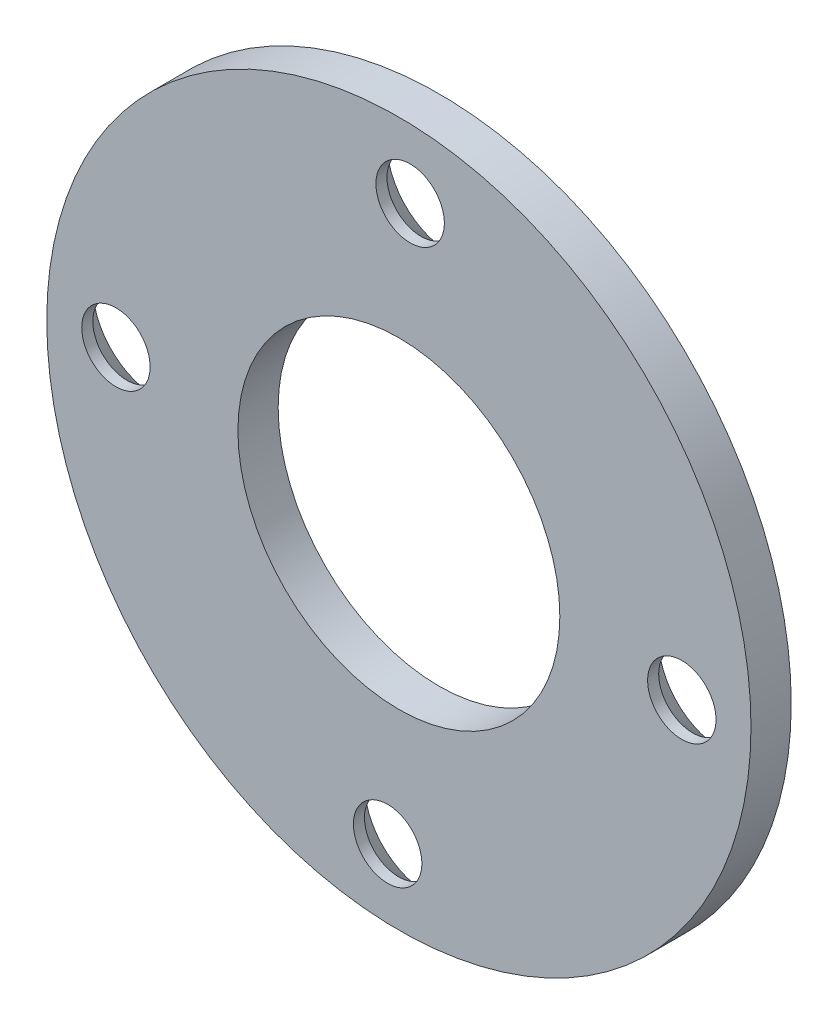
from build123d import *

# Parameters (mm, degrees)
SKETCH1_R                                    = 17.5
SKETCH1_R_2                                  = 8
BOSS_EXTRUDE1_DEPTH                          = 2
CSK_FOR_M3_COUNTERSUNK_FLAT_HEAD_SCR_2_COUNT = 2
CSK_FOR_M3_COUNTERSUNK_FLAT_HEAD_SCR_2_PITCH = 19.902355243
CSK_FOR_M3_COUNTERSUNK_FLAT_HEAD_SCR_3_COUNT = 2
CSK_FOR_M3_COUNTERSUNK_FLAT_HEAD_SCR_3_PITCH = 28.146180708
CSK_FOR_M3_COUNTERSUNK_FLAT_HEAD_SCR_4_COUNT = 2
CSK_FOR_M3_COUNTERSUNK_FLAT_HEAD_SCR_4_PITCH = 19.902355243


with BuildPart() as part:
    # Sketch1 → Boss-Extrude1 (new body)
    with BuildSketch(Plane.XY):
        Circle(SKETCH1_R)
        Circle(SKETCH1_R_2, mode=Mode.SUBTRACT)
    extrude(amount=BOSS_EXTRUDE1_DEPTH)

    # Sketch3 → CSK for M3 Countersunk Flat Head Screw1 (revolve, cut)
    with BuildSketch(Plane(origin=(0.559155654, 14.061977708, 0), x_dir=(0, 1, 0), z_dir=(1, 0, 0))):
        Polygon((0, 0), (0, 2), (1.7, 2), (1.7, 1.45), (3.15, 0), align=None)
    csk_for_m3_countersunk_flat_head_screw1 = revolve(axis=Axis((0.559155654, 14.061977708, -6.35), (0, 0, 1)), mode=Mode.SUBTRACT)

    # CSK for M3 Countersunk Flat Head Scr 2: CSK for M3 Countersunk Flat Head Screw1 ×2
    with Locations(*[Vector(-0.7346433717813886, -0.6784534739373604, 0) * (i * CSK_FOR_M3_COUNTERSUNK_FLAT_HEAD_SCR_2_PITCH) for i in range(1, CSK_FOR_M3_COUNTERSUNK_FLAT_HEAD_SCR_2_COUNT)]):
        add(csk_for_m3_countersunk_flat_head_screw1, mode=Mode.SUBTRACT)

    # CSK for M3 Countersunk Flat Head Scr 3: CSK for M3 Countersunk Flat Head Screw1 ×2
    with Locations(*[Vector(-0.03973225779969332, -0.9992103620810479, 0) * (i * CSK_FOR_M3_COUNTERSUNK_FLAT_HEAD_SCR_3_PITCH) for i in range(1, CSK_FOR_M3_COUNTERSUNK_FLAT_HEAD_SCR_3_COUNT)]):
        add(csk_for_m3_countersunk_flat_head_screw1, mode=Mode.SUBTRACT)

    # CSK for M3 Countersunk Flat Head Scr 4: CSK for M3 Countersunk Flat Head Screw1 ×2
    with Locations(*[Vector(0.6784534739373631, -0.7346433717813861, 0) * (i * CSK_FOR_M3_COUNTERSUNK_FLAT_HEAD_SCR_4_PITCH) for i in range(1, CSK_FOR_M3_COUNTERSUNK_FLAT_HEAD_SCR_4_COUNT)]):
        add(csk_for_m3_countersunk_flat_head_screw1, mode=Mode.SUBTRACT)


solid = part.part
